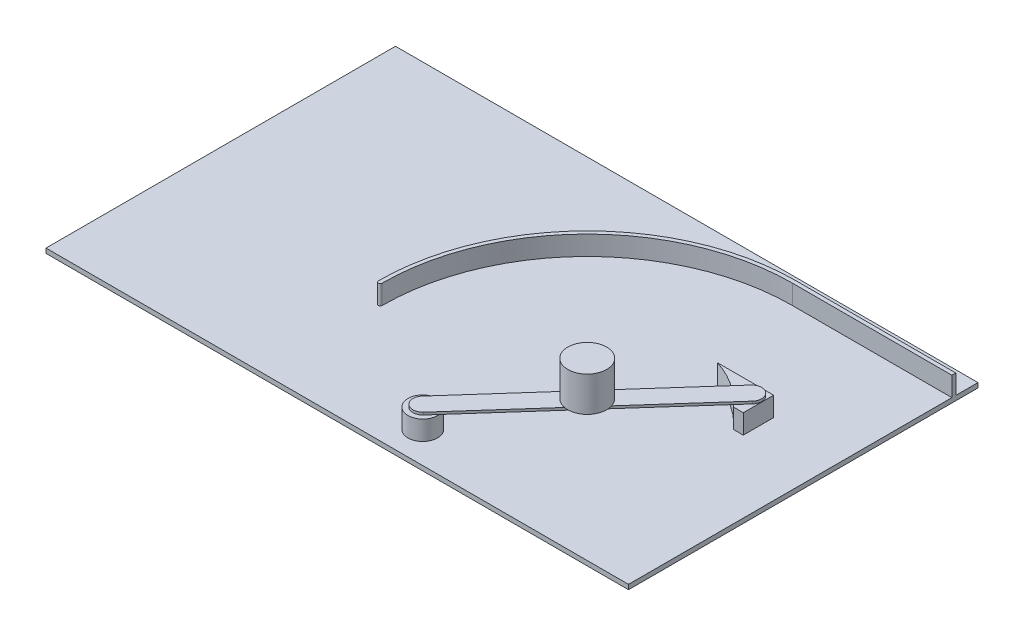
from build123d import *

# Parameters (mm, degrees)
SKETCH1_W           = 1500
SKETCH1_H           = 900
BOSS_EXTRUDE1_DEPTH = 12
BOSS_EXTRUDE2_DEPTH = 50
BOSS_EXTRUDE3_DEPTH = 50
BOSS_EXTRUDE4_DEPTH = 6.35
SKETCH5_R           = 38.1
BOSS_EXTRUDE5_DEPTH = 50
SKETCH6_R           = 50
BOSS_EXTRUDE6_DEPTH = 90


with BuildPart() as part:
    # Sketch1 → Boss-Extrude1 (new body)
    with BuildSketch(Plane(origin=(0, 0, 0), x_dir=(1, 0, 0), z_dir=(0, 1, 0))):
        Rectangle(SKETCH1_W, SKETCH1_H)
    extrude(amount=BOSS_EXTRUDE1_DEPTH)

    # Sketch2 → Boss-Extrude2 (add)
    with BuildSketch(Plane(origin=(0, 12, 0), x_dir=(1, 0, 0), z_dir=(0, 1, 0))):
        with BuildLine():
            Line((339, 382.8), (750, 382.8))
            Line((750, 382.8), (750, 392.8))
            Line((750, 392.8), (339, 392.8))
            ThreePointArc((339, 392.8), (-41.423448278, 235.223448278), (-199, -145.2))
            ThreePointArc((-199, -145.2), (-194, -150.2), (-189, -145.2))
            ThreePointArc((-189, -145.2), (-34.352380466, 228.152380466), (339, 382.8))
        make_face()
    extrude(amount=BOSS_EXTRUDE2_DEPTH)

    # Sketch3 → Boss-Extrude3 (add)
    with BuildSketch(Plane(origin=(0, 12, 0), x_dir=(1, 0, 0), z_dir=(0, 1, 0))):
        with BuildLine():
            Line((564.991489323, 108.8), (420.319677815, 108.8))
            ThreePointArc((420.319677815, 108.8), (485.283321394, 77.802421247), (539.591489323, 30.561043498))
            Line((539.591489323, 30.561043498), (564.991489323, 30.561043498))
            Line((564.991489323, 30.561043498), (564.991489323, 108.8))
        make_face()
    extrude(amount=BOSS_EXTRUDE3_DEPTH)

    # Sketch4 → Boss-Extrude4 (add)
    with BuildSketch(Plane(origin=(0, 62, 0), x_dir=(1, 0, 0), z_dir=(0, 1, 0))):
        with BuildLine():
            Line((120.609259907, -352.445373029), (519.438207109, 95.812890558))
            ThreePointArc((519.438207109, 95.812890558), (555.298232366, 97.905398285), (557.390740093, 62.045373029))
            Line((557.390740093, 62.045373029), (158.561792891, -386.212890558))
            ThreePointArc((158.561792891, -386.212890558), (122.701767634, -388.305398285), (120.609259907, -352.445373029))
        make_face()
    extrude(amount=BOSS_EXTRUDE4_DEPTH)

    # Sketch5 → Boss-Extrude5 (add)
    with BuildSketch(Plane(origin=(0, 12, 0), x_dir=(1, 0, 0), z_dir=(0, 1, 0))):
        with Locations(Location((139.585526399, -369.329131794, 0), (0, 0, 90.149856959))):
            Circle(SKETCH5_R)
    extrude(amount=BOSS_EXTRUDE5_DEPTH)

    # Sketch6 → Boss-Extrude6 (add)
    with BuildSketch(Plane(origin=(0, 68.35, 0), x_dir=(1, 0, 0), z_dir=(0, 1, 0))):
        with Locations(Location((339, -145.2, 0), (0, 0, 78.870244402))):
            Circle(SKETCH6_R)
    extrude(amount=BOSS_EXTRUDE6_DEPTH)


solid = part.part
